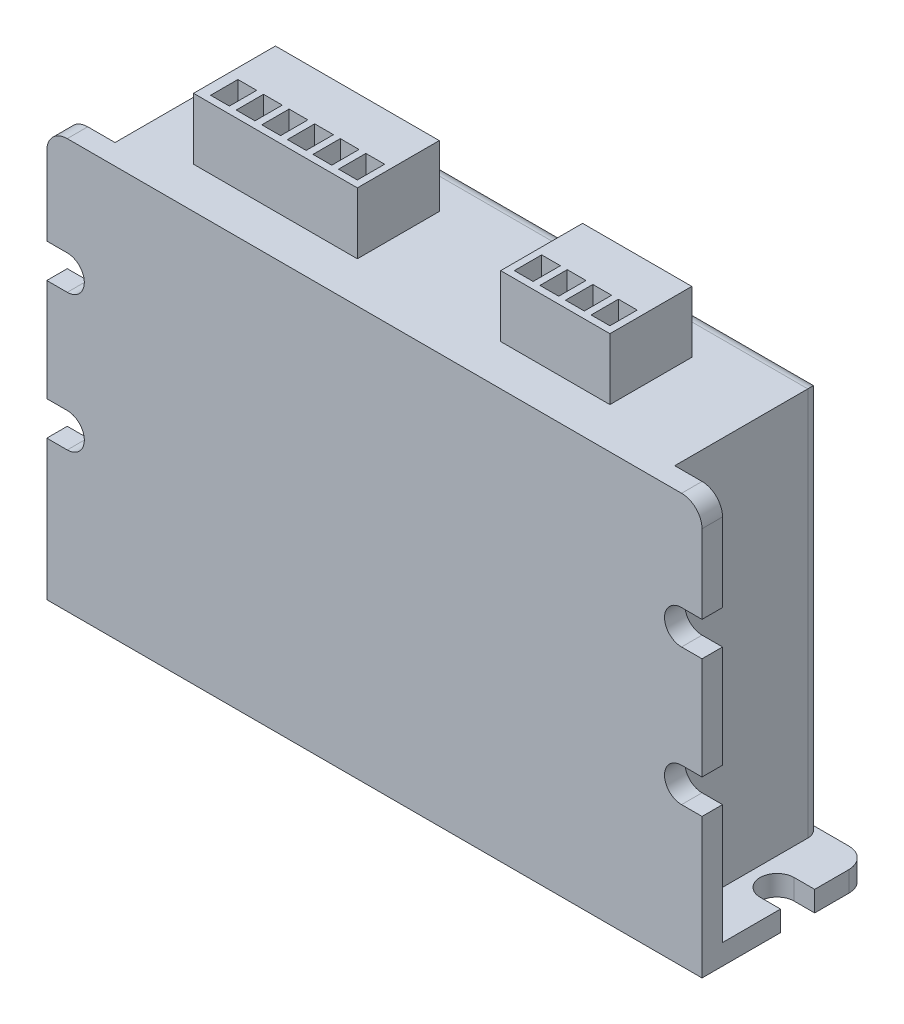
from build123d import *

# Parameters (mm, degrees)
SKETCH1_W           = 96
SKETCH1_H           = 24.5
BOSS_EXTRUDE1_DEPTH = 3
BOSS_EXTRUDE2_DEPTH = 57
FILLET1_R           = 2
FILLET2_R           = 3
CUT_EXTRUDE1_REACH  = 117.231
CUT_EXTRUDE2_REACH  = 116.303
SKETCH5_W           = 16
SKETCH5_H           = 12
SKETCH5_W_2         = 24
BOSS_EXTRUDE3_DEPTH = 9
SKETCH6_W           = 2.75
SKETCH6_H           = 4
CUT_EXTRUDE3_DEPTH  = 6
LPATTERN1_COUNT     = 4
LPATTERN1_PITCH     = 3.75
SKETCH7_W           = 2.75
SKETCH7_H           = 4
CUT_EXTRUDE4_DEPTH  = 6
LPATTERN2_COUNT     = 6
LPATTERN2_PITCH     = 3.75


with BuildPart() as part:
    # Sketch1 → Boss-Extrude1 (new body)
    with BuildSketch(Plane(origin=(0, 0, 0), x_dir=(1, 0, 0), z_dir=(0, 1, 0))):
        with Locations((48, 12.25)):
            Rectangle(SKETCH1_W, SKETCH1_H)
    extrude(amount=BOSS_EXTRUDE1_DEPTH)

    # Sketch2 → Boss-Extrude2 (add)
    with BuildSketch(Plane(origin=(0, 3, 0), x_dir=(1, 0, 0), z_dir=(0, 1, 0))):
        Polygon((0, 0), (96, 0), (96, 3), (89, 3), (89, 24.5), (7, 24.5), (7, 3), (0, 3), align=None)
    extrude(amount=BOSS_EXTRUDE2_DEPTH)

    # Fillet1
    fillet1_edges = [part.edges().sort_by_distance(p)[0] for p in [
        (89, 31.5, -24.5),
        (7, 31.5, -24.5),
        (48, 60, -24.5),
    ]]
    fillet(fillet1_edges, radius=FILLET1_R)

    # Fillet2
    fillet2_edges = [part.edges().sort_by_distance(p)[0] for p in [
        (0, 60, -1.5),
        (96, 60, -1.5),
        (0, 1.5, -24.5),
        (96, 1.5, -24.5),
    ]]
    fillet(fillet2_edges, radius=FILLET2_R)

    # Sketch3 → Cut-Extrude1 (cut, up to next)
    with BuildSketch(Plane(origin=(0, 0, -3), x_dir=(-1, 0, 0), z_dir=(0, 0, -1)), mode=Mode.PRIVATE) as cut_extrude1_sk1:
        with BuildLine():
            Line((-93, 45.5), (-96, 45.5))
            Line((-96, 45.5), (-96, 40.5))
            Line((-96, 40.5), (-93, 40.5))
            ThreePointArc((-93, 40.5), (-90.5, 43), (-93, 45.5))
        make_face()
    cut_extrude1_tool1 = extrude(cut_extrude1_sk1.sketch, amount=-CUT_EXTRUDE1_REACH, mode=Mode.PRIVATE) & part.part
    # Sketch3 → Cut-Extrude1 (cut, up to next)
    with BuildSketch(Plane(origin=(0, 0, -3), x_dir=(-1, 0, 0), z_dir=(0, 0, -1)), mode=Mode.PRIVATE) as cut_extrude1_sk2:
        with BuildLine():
            Line((-93, 25.5), (-96, 25.5))
            Line((-96, 25.5), (-96, 20.5))
            Line((-96, 20.5), (-93, 20.5))
            ThreePointArc((-93, 20.5), (-90.5, 23), (-93, 25.5))
        make_face()
    cut_extrude1_tool2 = extrude(cut_extrude1_sk2.sketch, amount=-CUT_EXTRUDE1_REACH, mode=Mode.PRIVATE) & part.part
    # Sketch3 → Cut-Extrude1 (cut, up to next)
    with BuildSketch(Plane(origin=(0, 0, -3), x_dir=(-1, 0, 0), z_dir=(0, 0, -1)), mode=Mode.PRIVATE) as cut_extrude1_sk3:
        with BuildLine():
            Line((-3, 25.5), (0, 25.5))
            Line((0, 25.5), (0, 20.5))
            Line((0, 20.5), (-3, 20.5))
            ThreePointArc((-3, 20.5), (-5.5, 23), (-3, 25.5))
        make_face()
    cut_extrude1_tool3 = extrude(cut_extrude1_sk3.sketch, amount=-CUT_EXTRUDE1_REACH, mode=Mode.PRIVATE) & part.part
    # Sketch3 → Cut-Extrude1 (cut, up to next)
    with BuildSketch(Plane(origin=(0, 0, -3), x_dir=(-1, 0, 0), z_dir=(0, 0, -1)), mode=Mode.PRIVATE) as cut_extrude1_sk4:
        with BuildLine():
            Line((-3, 45.5), (0, 45.5))
            Line((0, 45.5), (0, 40.5))
            Line((0, 40.5), (-3, 40.5))
            ThreePointArc((-3, 40.5), (-5.5, 43), (-3, 45.5))
        make_face()
    cut_extrude1_tool4 = extrude(cut_extrude1_sk4.sketch, amount=-CUT_EXTRUDE1_REACH, mode=Mode.PRIVATE) & part.part
    add(cut_extrude1_tool1.solids().sort_by_distance((93.486888, 43, -3))[0], mode=Mode.SUBTRACT)
    add(cut_extrude1_tool2.solids().sort_by_distance((93.486888, 23, -3))[0], mode=Mode.SUBTRACT)
    add(cut_extrude1_tool3.solids().sort_by_distance((2.513112, 23, -3))[0], mode=Mode.SUBTRACT)
    add(cut_extrude1_tool4.solids().sort_by_distance((2.513112, 43, -3))[0], mode=Mode.SUBTRACT)

    # Sketch4 → Cut-Extrude2 (cut, up to next)
    with BuildSketch(Plane(origin=(0, 3, 0), x_dir=(1, 0, 0), z_dir=(0, 1, 0)), mode=Mode.PRIVATE) as cut_extrude2_sk1:
        with BuildLine():
            Line((3, 16.5), (0, 16.5))
            Line((0, 16.5), (0, 11.5))
            Line((0, 11.5), (3, 11.5))
            ThreePointArc((3, 11.5), (5.5, 14), (3, 16.5))
        make_face()
    cut_extrude2_tool1 = extrude(cut_extrude2_sk1.sketch, amount=-CUT_EXTRUDE2_REACH, mode=Mode.PRIVATE) & part.part
    # Sketch4 → Cut-Extrude2 (cut, up to next)
    with BuildSketch(Plane(origin=(0, 3, 0), x_dir=(1, 0, 0), z_dir=(0, 1, 0)), mode=Mode.PRIVATE) as cut_extrude2_sk2:
        with BuildLine():
            Line((93, 11.5), (96, 11.5))
            Line((96, 11.5), (96, 16.5))
            Line((96, 16.5), (93, 16.5))
            ThreePointArc((93, 16.5), (90.5, 14), (93, 11.5))
        make_face()
    cut_extrude2_tool2 = extrude(cut_extrude2_sk2.sketch, amount=-CUT_EXTRUDE2_REACH, mode=Mode.PRIVATE) & part.part
    add(cut_extrude2_tool1.solids().sort_by_distance((2.513112, 3, -14))[0], mode=Mode.SUBTRACT)
    add(cut_extrude2_tool2.solids().sort_by_distance((93.486888, 3, -14))[0], mode=Mode.SUBTRACT)

    # Sketch5 → Boss-Extrude3 (add)
    with BuildSketch(Plane(origin=(0, 60, 0), x_dir=(1, 0, 0), z_dir=(0, 1, 0))):
        with Locations((68.5, 12)):
            Rectangle(SKETCH5_W, SKETCH5_H)
        with Locations((27.5, 12)):
            Rectangle(SKETCH5_W_2, SKETCH5_H)
    extrude(amount=BOSS_EXTRUDE3_DEPTH)

    # Sketch6 → Cut-Extrude3 (cut)
    with BuildSketch(Plane(origin=(0, 69, 0), x_dir=(1, 0, 0), z_dir=(0, 1, 0))):
        with Locations((74.125, 9)):
            Rectangle(SKETCH6_W, SKETCH6_H)
    cut_extrude3 = extrude(amount=-CUT_EXTRUDE3_DEPTH, mode=Mode.SUBTRACT)

    # LPattern1: Cut-Extrude3 ×4
    with Locations(*[(-i * LPATTERN1_PITCH, 0, 0) for i in range(1, LPATTERN1_COUNT)]):
        add(cut_extrude3, mode=Mode.SUBTRACT)

    # Sketch7 → Cut-Extrude4 (cut)
    with BuildSketch(Plane(origin=(0, 69, 0), x_dir=(1, 0, 0), z_dir=(0, 1, 0))):
        with Locations((37.125, 9)):
            Rectangle(SKETCH7_W, SKETCH7_H)
    cut_extrude4 = extrude(amount=-CUT_EXTRUDE4_DEPTH, mode=Mode.SUBTRACT)

    # LPattern2: Cut-Extrude4 ×6
    with Locations(*[(-i * LPATTERN2_PITCH, 0, 0) for i in range(1, LPATTERN2_COUNT)]):
        add(cut_extrude4, mode=Mode.SUBTRACT)


solid = part.part
